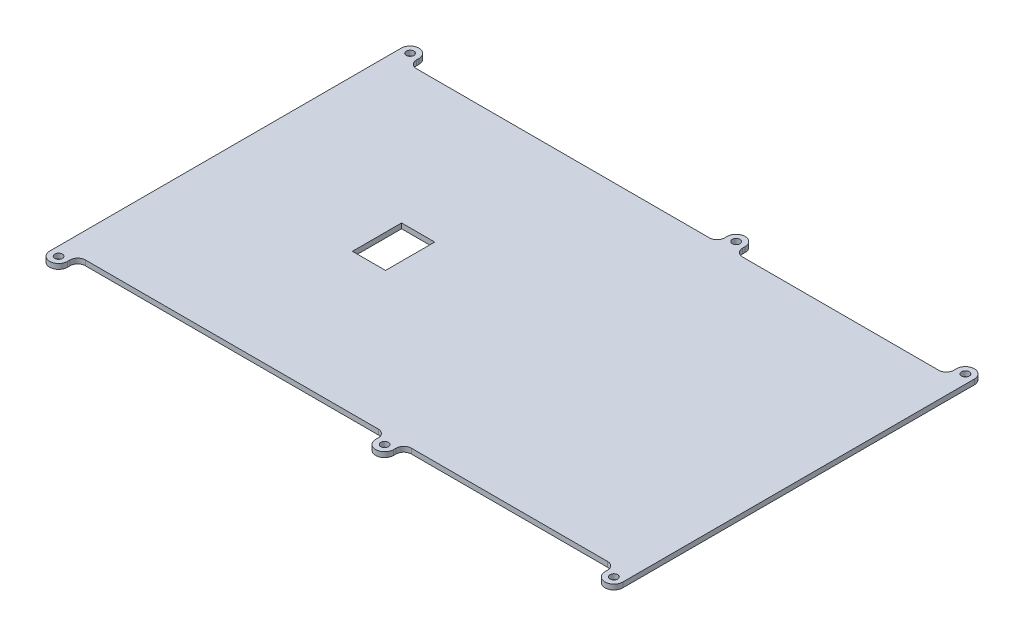
from build123d import *

# Parameters (mm, degrees)
SKETCH1_R           = 1.5
SKETCH1_W           = 13
SKETCH1_H           = 19.3
BOSS_EXTRUDE1_DEPTH = 1
FILLET1_R           = 3


with BuildPart() as part:
    # Sketch1 → Boss-Extrude1 (new, symmetric)
    with BuildSketch(Plane(origin=(0, 0, 0), x_dir=(1, 0, 0), z_dir=(0, 1, 0))):
        with BuildLine():
            Line((-105.5, 65), (-105.5, 69))
            ThreePointArc((-105.5, 69), (-109, 72.5), (-112.5, 69))
            Line((-112.5, 69), (-112.5, 65))
            Line((-112.5, 65), (-112.5, -65))
            Line((-112.5, -65), (-112.5, -69))
            ThreePointArc((-112.5, -69), (-109, -72.5), (-105.5, -69))
            Line((-105.5, -69), (-105.5, -65))
            Line((-105.5, -65), (15.5, -65))
            Line((15.5, -65), (15.5, -69))
            ThreePointArc((15.5, -69), (19, -72.5), (22.5, -69))
            Line((22.5, -69), (22.5, -65))
            Line((22.5, -65), (105.5, -65))
            Line((105.5, -65), (105.5, -69))
            ThreePointArc((105.5, -69), (109, -72.5), (112.5, -69))
            Line((112.5, -69), (112.5, -65))
            Line((112.5, -65), (112.5, 65))
            Line((112.5, 65), (112.5, 69))
            ThreePointArc((112.5, 69), (109, 72.5), (105.5, 69))
            Line((105.5, 69), (105.5, 65))
            Line((105.5, 65), (22.5, 65))
            Line((22.5, 65), (22.5, 69))
            ThreePointArc((22.5, 69), (19, 72.5), (15.5, 69))
            Line((15.5, 69), (15.5, 65))
            Line((15.5, 65), (-105.5, 65))
        make_face()
        with Locations(Location((-109, 69, 0), (0, 0, 270))):
            Circle(SKETCH1_R, mode=Mode.SUBTRACT)
        with Locations(Location((109, 69, 0), (0, 0, 90))):
            Circle(SKETCH1_R, mode=Mode.SUBTRACT)
        with Locations(Location((19, 69, 0), (0, 0, 270))):
            Circle(SKETCH1_R, mode=Mode.SUBTRACT)
        with Locations(Location((19, -69, 0), (0, 0, 90))):
            Circle(SKETCH1_R, mode=Mode.SUBTRACT)
        with Locations(Location((109, -69, 0), (0, 0, 270))):
            Circle(SKETCH1_R, mode=Mode.SUBTRACT)
        with Locations(Location((-109, -69, 0), (0, 0, 90))):
            Circle(SKETCH1_R, mode=Mode.SUBTRACT)
        with Locations((-46.5, 0)):
            Rectangle(SKETCH1_W, SKETCH1_H, mode=Mode.SUBTRACT)
    extrude(amount=BOSS_EXTRUDE1_DEPTH, both=True)

    # Fillet1
    fillet1_edges = [part.edges().sort_by_distance(p)[0] for p in [
        (-105.5, 0, -65),
        (15.5, 0, -65),
        (22.5, 0, -65),
        (105.5, 0, -65),
        (105.5, 0, 65),
        (22.5, 0, 65),
        (15.5, 0, 65),
        (-105.5, 0, 65),
    ]]
    fillet(fillet1_edges, radius=FILLET1_R)


solid = part.part
